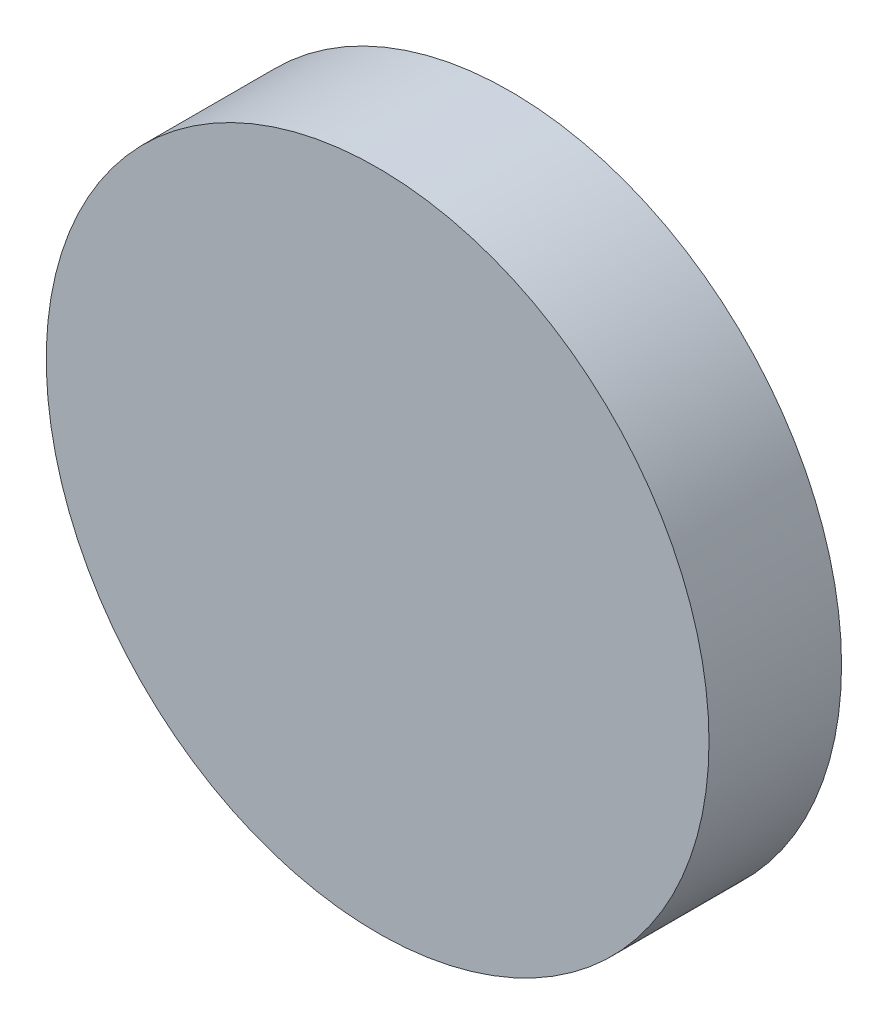
from build123d import *

# Parameters (mm, degrees)
ESQUISSE1_R        = 12.7
BOSS_EXTRU_1_DEPTH = 2.54


with BuildPart() as part:
    # Esquisse1 → Boss.-Extru.1 (new, symmetric)
    with BuildSketch(Plane.XY):
        Circle(ESQUISSE1_R)
    extrude(amount=BOSS_EXTRU_1_DEPTH, both=True)


solid = part.part
